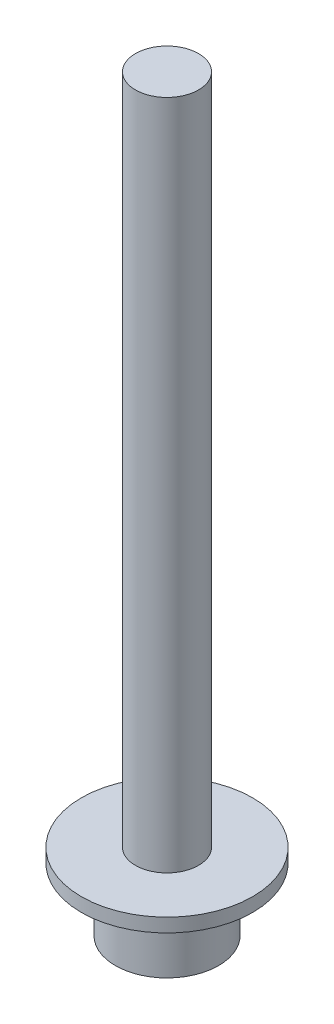
from build123d import *

# Parameters (mm, degrees)
SKETCH1_ONE_SIDE_W   = 1.7526
SKETCH1_ONE_SIDE_H   = 38.1
SKETCH1_ONE_SIDE_W_2 = 2.8702
SKETCH1_ONE_SIDE_H_2 = 3.5052
SKETCH1_ONE_SIDE_W_3 = 4.7625
SKETCH1_ONE_SIDE_H_3 = 0.762


with BuildPart() as part:
    # Sketch1 one side → Revolve1 (revolve)
    with BuildSketch(Plane(origin=(-24.412739892, 0, -3.433041547), x_dir=(0.13925483139909503, 0, -0.9902565788380351), z_dir=(0.9902565788380351, 0, 0.13925483139909503)), mode=Mode.PRIVATE) as revolve1_sk:
        with Locations((9.484713498, -19.83540516)):
            Rectangle(SKETCH1_ONE_SIDE_W, SKETCH1_ONE_SIDE_H)
        with Locations((8.925913498, -40.63800516)):
            Rectangle(SKETCH1_ONE_SIDE_W_2, SKETCH1_ONE_SIDE_H_2)
        with Locations((7.979763498, -38.50440516)):
            Rectangle(SKETCH1_ONE_SIDE_W_3, SKETCH1_ONE_SIDE_H_3)
    revolve(revolve1_sk.sketch.rotate(Axis((-22.969918704, -42.39060516, -13.693103328), (0, 1, 0)), 188.004728857), axis=Axis((-22.969918704, -42.39060516, -13.693103328), (0, 1, 0)))


solid = part.part
